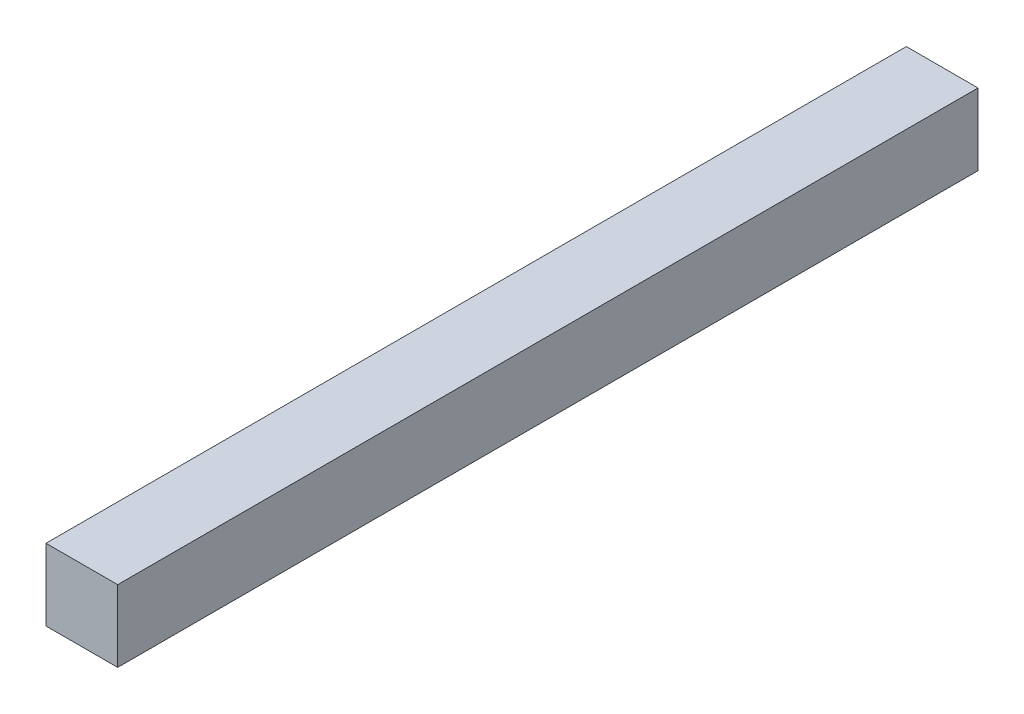
from build123d import *

# Parameters (mm, degrees)
SKETCH1_W           = 240
SKETCH1_H           = 20
BOSS_EXTRUDE1_DEPTH = 20
SKETCH2_W           = 0.610576923
SKETCH2_H           = 5.427350427
CUT_EXTRUDE1_DEPTH  = 4


with BuildPart() as part:
    # Sketch1 → Boss-Extrude1 (new body)
    with BuildSketch(Plane(origin=(0, 0, 0), x_dir=(0, 0, -1), z_dir=(1, 0, 0))):
        Rectangle(SKETCH1_W, SKETCH1_H)
    extrude(amount=BOSS_EXTRUDE1_DEPTH)

    # Sketch2 → Cut-Extrude1 (cut)
    # profile 1 of 6: a face of its own
    with BuildSketch(Plane(origin=(0, 0, 0), x_dir=(0, 0, -1), z_dir=(1, 0, 0))):
        with BuildLine():
            Line((-8.751602564, 5.427350427), (-9.362179487, 5.427350427))
            Line((-9.362179487, 5.427350427), (-9.362179487, 3.136626936))
            add(Edge.make_bspline(
                [(-9.362179487, 3.136626936), (-9.421668284, 3.200496063), (-9.538282896, 3.325697342), (-9.732047214, 3.487703852), (-9.932322109, 3.627202133), (-10.143270282, 3.739205359), (-10.362919536, 3.826800408), (-10.591827341, 3.889415018), (-10.82975499, 3.927467645), (-10.991305298, 3.932355358), (-11.073066907, 3.93482906)],
                knots=[0, 0, 0, 0, 1.07415008, 2.105633337, 3.103998732, 4.075565931, 5.040540589, 6.010859238, 6.993283574, 8, 8, 8, 8], degree=3))
            add(Edge.make_bspline(
                [(-11.073066907, 3.93482906), (-11.115140066, 3.934337126), (-11.198012626, 3.93336815), (-11.320435747, 3.922128741), (-11.439334916, 3.905280786), (-11.55492815, 3.88235118), (-11.666844517, 3.851419616), (-11.775008685, 3.812987353), (-11.87990196, 3.768628269), (-11.980730002, 3.718031271), (-12.075716596, 3.660350246), (-12.16584768, 3.599554702), (-12.249167468, 3.533332783), (-12.325823049, 3.462180231), (-12.395593801, 3.385644331), (-12.459636722, 3.305289996), (-12.5158899, 3.219345233), (-12.567791259, 3.128593488), (-12.613190351, 3.028065022), (-12.650694919, 2.915689145), (-12.681890166, 2.790384349), (-12.710237883, 2.652678599), (-12.728951301, 2.501273018), (-12.74428995, 2.337281871), (-12.752255474, 2.160417422), (-12.753585672, 2.038089349), (-12.754273504, 1.974834736)],
                knots=[0, 0, 0, 0, 1.021683283, 2.012435314, 2.983473585, 3.937869172, 4.872808728, 5.801185558, 6.724190829, 7.637729951, 8.538560957, 9.421760501, 10.276949778, 11.121084872, 11.959396615, 12.790471507, 13.614111827, 14.451940127, 15.327769077, 16.288588017, 17.325266595, 18.463133286, 19.701266581, 21.028475566, 22.463454662, 24, 24, 24, 24], degree=3))
            Line((-12.754273504, 1.974834736), (-12.754273504, 0))
            Line((-12.754273504, 0), (-12.143696581, 0))
            Line((-12.143696581, 0), (-12.143696581, 1.819010417))
            add(Edge.make_bspline(
                [(-12.143696581, 1.819010417), (-12.143558057, 1.871662121), (-12.143293067, 1.972382366), (-12.139537139, 2.116532517), (-12.136329475, 2.247366394), (-12.128273111, 2.364276534), (-12.120461991, 2.467583112), (-12.109720221, 2.557011842), (-12.09809782, 2.632986732), (-12.086411143, 2.678406458), (-12.081154848, 2.698834802)],
                knots=[0, 0, 0, 0, 1.429454469, 2.734479441, 3.915096125, 4.982083123, 5.9158061, 6.72734519, 7.427600459, 8, 8, 8, 8], degree=3))
            add(Edge.make_bspline(
                [(-12.081154848, 2.698834802), (-12.071716526, 2.729726568), (-12.053245782, 2.790181586), (-12.018341898, 2.876655997), (-11.976089483, 2.95653606), (-11.930460726, 3.031765724), (-11.877550112, 3.100068016), (-11.820537852, 3.162942351), (-11.757197314, 3.219586635), (-11.688465687, 3.270557736), (-11.613770605, 3.314614931), (-11.534642428, 3.354998099), (-11.449091583, 3.387028953), (-11.357987672, 3.413703066), (-11.262031058, 3.434776007), (-11.160036743, 3.449745892), (-11.052706831, 3.457864224), (-10.979090322, 3.459237149), (-10.941623264, 3.459935897)],
                knots=[0, 0, 0, 0, 1.040890899, 2.037017845, 2.999772166, 3.951073996, 4.869069183, 5.779972212, 6.683224964, 7.603478097, 8.53319658, 9.475456454, 10.463214634, 11.472278836, 12.533409461, 13.627045924, 14.792287113, 16, 16, 16, 16], degree=3))
            add(Edge.make_bspline(
                [(-10.941623264, 3.459935897), (-10.898125468, 3.459223869), (-10.812316437, 3.457819236), (-10.685065275, 3.443522416), (-10.561530673, 3.420099373), (-10.440588862, 3.388835222), (-10.324632133, 3.345549076), (-10.210609973, 3.2959497), (-10.101149846, 3.235227369), (-9.995281165, 3.166894898), (-9.896930136, 3.09071371), (-9.804713262, 3.011268091), (-9.722031541, 2.926541357), (-9.648639704, 2.83692262), (-9.583491446, 2.743691072), (-9.528131426, 2.645229123), (-9.481307928, 2.542696659), (-9.457001728, 2.471504885), (-9.444861779, 2.435947516)],
                knots=[0, 0, 0, 0, 1.077093923, 2.124806198, 3.16676328, 4.190026369, 5.214449133, 6.229293254, 7.267272823, 8.311139597, 9.347457364, 10.346171291, 11.324074378, 12.275494987, 13.212638205, 14.137563464, 15.069789411, 16, 16, 16, 16], degree=3))
            add(Edge.make_bspline(
                [(-9.444861779, 2.435947516), (-9.438169665, 2.410226644), (-9.423604085, 2.354244418), (-9.407619679, 2.261692315), (-9.392052649, 2.154351492), (-9.383133262, 2.031759), (-9.37254108, 1.894409359), (-9.367154865, 1.742364007), (-9.362353099, 1.575234639), (-9.362239085, 1.458958548), (-9.362179487, 1.398178753)],
                knots=[0, 0, 0, 0, 0.610940434, 1.329729645, 2.15826949, 3.104343598, 4.155103487, 5.326215764, 6.602360509, 8, 8, 8, 8], degree=3))
            Line((-9.362179487, 1.398178753), (-9.362179487, 0))
            Line((-9.362179487, 0), (-8.751602564, 0))
            Line((-8.751602564, 0), (-8.751602564, 5.427350427))
        make_face()
    # profile 2 of 6: a face of its own
    with BuildSketch(Plane(origin=(0, 0, 0), x_dir=(0, 0, -1), z_dir=(1, 0, 0))):
        Polygon((-6.377136752, 5.427350427), (-6.987713675, 5.427350427), (-6.987713675, 3.866987179), (-7.801816239, 3.866987179), (-7.801816239, 3.392094017), (-6.987713675, 3.392094017), (-6.987713675, 0), (-6.377136752, 0), (-6.377136752, 3.392094017), (-5.563034188, 3.392094017), (-5.563034188, 3.866987179), (-6.377136752, 3.866987179), align=None)
    # profile 3 of 6: a face of its own
    with BuildSketch(Plane(origin=(0, 0, 0), x_dir=(0, 0, -1), z_dir=(1, 0, 0))):
        with BuildLine():
            Line((-3.93482906, 3.866987179), (-4.545405983, 3.866987179))
            Line((-4.545405983, 3.866987179), (-4.545405983, 0.798202123))
            add(Edge.make_bspline(
                [(-4.545405983, 0.798202123), (-4.545240943, 0.732820739), (-4.544922304, 0.606590178), (-4.53570058, 0.424219199), (-4.52358332, 0.255523639), (-4.506078619, 0.100113642), (-4.481629768, -0.041307378), (-4.453184167, -0.169509355), (-4.420359952, -0.284409321), (-4.391589809, -0.354616076), (-4.377921341, -0.387970753)],
                knots=[0, 0, 0, 0, 1.301533202, 2.51284472, 3.634575474, 4.668610574, 5.625072911, 6.490366044, 7.282784772, 8, 8, 8, 8], degree=3))
            add(Edge.make_bspline(
                [(-4.377921341, -0.387970753), (-4.357908047, -0.43150625), (-4.318215534, -0.517850527), (-4.244060083, -0.639559609), (-4.158850333, -0.752835095), (-4.064194839, -0.859597429), (-3.958701949, -0.95843615), (-3.842628916, -1.049740083), (-3.71628201, -1.133778404), (-3.579402029, -1.208482713), (-3.433844145, -1.275489873), (-3.280248661, -1.333120952), (-3.120255776, -1.383754887), (-2.952315443, -1.422047516), (-2.778097855, -1.454448576), (-2.596079423, -1.475974205), (-2.407211999, -1.490518045), (-2.27873878, -1.491845597), (-2.213341346, -1.492521368)],
                knots=[0, 0, 0, 0, 0.892361144, 1.769826507, 2.649562032, 3.531070128, 4.425493976, 5.339743849, 6.280293132, 7.249898151, 8.242834287, 9.264015286, 10.305378017, 11.367518935, 12.471830068, 13.606296802, 14.781520001, 16, 16, 16, 16], degree=3))
            add(Edge.make_bspline(
                [(-2.213341346, -1.492521368), (-2.118207741, -1.491222444), (-1.932464228, -1.488686361), (-1.661715771, -1.459368849), (-1.405036427, -1.417709788), (-1.165299406, -1.354853383), (-0.943923682, -1.277825478), (-0.742570927, -1.189010091), (-0.562082597, -1.088747116), (-0.400546348, -0.972818082), (-0.254547455, -0.835114758), (-0.116222332, -0.673381421), (0.016523246, -0.484144733), (0.094888882, -0.344212293), (0.135683761, -0.271367521)],
                knots=[0, 0, 0, 0, 1.220149806, 2.382280289, 3.490641873, 4.554024904, 5.557741845, 6.495463758, 7.374449758, 8.202461232, 9.039706035, 9.943084277, 10.9292293, 12, 12, 12, 12], degree=3))
            Line((0.135683761, -0.271367521), (-0.474893162, -0.271367521))
            add(Edge.make_bspline(
                [(-0.474893162, -0.271367521), (-0.519447092, -0.332200691), (-0.607336708, -0.452203663), (-0.768684554, -0.605630443), (-0.946354299, -0.73614642), (-1.110064697, -0.823561811), (-1.250401876, -0.879066453), (-1.3622078, -0.916294976), (-1.480273133, -0.948509936), (-1.604756047, -0.972983278), (-1.735132133, -0.993883069), (-1.871802195, -1.006909284), (-2.014648444, -1.015679133), (-2.111917926, -1.016971013), (-2.161399907, -1.017628205)],
                knots=[0, 0, 0, 0, 1.406411641, 2.774367649, 4.13970867, 5.515970748, 6.226996413, 6.957671546, 7.716753095, 8.511703955, 9.326821042, 10.182754768, 11.075548767, 12, 12, 12, 12], degree=3))
            add(Edge.make_bspline(
                [(-2.161399907, -1.017628205), (-2.210174792, -1.016967501), (-2.306031196, -1.01566903), (-2.4467679, -1.00695501), (-2.581986706, -0.993670999), (-2.711035789, -0.973274657), (-2.834686878, -0.948191661), (-2.952121008, -0.916329046), (-3.063907787, -0.87905923), (-3.170008566, -0.837114713), (-3.268779764, -0.788992247), (-3.361461581, -0.73993744), (-3.445692506, -0.686163459), (-3.523321634, -0.630419363), (-3.593161156, -0.570873518), (-3.656404734, -0.509346702), (-3.711702665, -0.444382526), (-3.760820734, -0.375320979), (-3.802591958, -0.298451716), (-3.839004574, -0.211971478), (-3.867658355, -0.113540908), (-3.893534257, -0.004727454), (-3.911846901, 0.115847828), (-3.925884856, 0.247398647), (-3.932527519, 0.390378085), (-3.93404411, 0.489376067), (-3.93482906, 0.540614984)],
                knots=[0, 0, 0, 0, 1.284615551, 2.524631777, 3.71274724, 4.861840311, 5.964270962, 7.034369188, 8.064422103, 9.066774622, 10.036673369, 10.956946004, 11.82705178, 12.666609064, 13.47215512, 14.242132945, 14.988114445, 15.716233977, 16.470126793, 17.287679463, 18.182663732, 19.166922939, 20.231828452, 21.392172702, 22.650252828, 24, 24, 24, 24], degree=3))
            Line((-3.93482906, 0.540614984), (-3.93482906, 0.740960537))
            add(Edge.make_bspline(
                [(-3.93482906, 0.740960537), (-3.87814683, 0.683392198), (-3.764682515, 0.568154103), (-3.570599741, 0.419493126), (-3.35880585, 0.292036824), (-3.130743584, 0.186587921), (-2.890466092, 0.102589883), (-2.64061644, 0.044058671), (-2.383750669, 0.006196652), (-2.209941846, 0.002079111), (-2.122178819, 0)],
                knots=[0, 0, 0, 0, 0.9616226, 1.924939268, 2.903225655, 3.90145387, 4.913304235, 5.930317158, 6.954934346, 8, 8, 8, 8], degree=3))
            add(Edge.make_bspline(
                [(-2.122178819, 0), (-2.070561788, 0.000790342), (-1.96752531, 0.002368002), (-1.814373416, 0.015828452), (-1.663509749, 0.035391068), (-1.515288983, 0.064501341), (-1.369338277, 0.101178178), (-1.225937252, 0.14736591), (-1.084530786, 0.200183246), (-0.94640953, 0.261270977), (-0.813572503, 0.330030127), (-0.687324815, 0.403931861), (-0.568868102, 0.483705609), (-0.458713984, 0.569808161), (-0.355614619, 0.660723153), (-0.260702791, 0.757829721), (-0.173798187, 0.860484154), (-0.095359744, 0.96870809), (-0.025589435, 1.081180766), (0.036342233, 1.196181443), (0.087132601, 1.314965174), (0.129753477, 1.435587308), (0.162962534, 1.559251812), (0.185697156, 1.685874462), (0.201695624, 1.815069333), (0.202913557, 1.902350125), (0.203525641, 1.946213942)],
                knots=[0, 0, 0, 0, 1.102496069, 2.200771917, 3.282212953, 4.351067109, 5.425742796, 6.495236474, 7.567789237, 8.649230273, 9.719442957, 10.761602243, 11.772820946, 12.767879558, 13.746423923, 14.707251758, 15.666031455, 16.617263585, 17.559830464, 18.491849916, 19.404720472, 20.31668551, 21.223041296, 22.136535823, 23.063497827, 24, 24, 24, 24], degree=3))
            add(Edge.make_bspline(
                [(0.203525641, 1.946213942), (0.202316232, 1.990057992), (0.199901466, 2.077599234), (0.186343978, 2.207780616), (0.161926824, 2.335824583), (0.126189384, 2.460865557), (0.08319085, 2.584610186), (0.028838002, 2.70529273), (-0.035486579, 2.823628085), (-0.108155553, 2.939576686), (-0.189336155, 3.052031061), (-0.279828068, 3.157554607), (-0.376727249, 3.258246218), (-0.481656807, 3.351919996), (-0.593291509, 3.440917187), (-0.71354346, 3.521679971), (-0.839887467, 3.598957901), (-0.973752304, 3.667989443), (-1.112314876, 3.730050658), (-1.253000599, 3.78600366), (-1.396533994, 3.830621082), (-1.541136699, 3.87010409), (-1.688416472, 3.897647306), (-1.836875666, 3.919306883), (-1.987318684, 3.932431224), (-2.088232537, 3.934025045), (-2.13913929, 3.93482906)],
                knots=[0, 0, 0, 0, 0.927022606, 1.850940105, 2.763646773, 3.678917571, 4.597960441, 5.530863249, 6.473405952, 7.443374224, 8.422047587, 9.402429927, 10.379733957, 11.374159407, 12.373957143, 13.39539851, 14.434361868, 15.503500072, 16.57672747, 17.643462173, 18.701820727, 19.752719066, 20.810444757, 21.866850764, 22.923916819, 24, 24, 24, 24], degree=3))
            add(Edge.make_bspline(
                [(-2.13913929, 3.93482906), (-2.222629312, 3.932802344), (-2.387005517, 3.928812122), (-2.629226974, 3.896885248), (-2.862943058, 3.846722852), (-3.089552027, 3.773939584), (-3.310945221, 3.676107562), (-3.525826802, 3.544666571), (-3.736924345, 3.382916343), (-3.86753272, 3.25605441), (-3.93482906, 3.190688435)],
                knots=[0, 0, 0, 0, 1.000657623, 1.970107281, 2.924012196, 3.863137721, 4.818884552, 5.818573257, 6.876013614, 8, 8, 8, 8], degree=3))
            Line((-3.93482906, 3.190688435), (-3.93482906, 3.866987179))
        make_face()
        with BuildLine():
            add(Edge.make_bspline(
                [(-2.210161258, 3.459935897), (-2.130143012, 3.457569941), (-1.971654845, 3.452883807), (-1.738889872, 3.413127161), (-1.51399214, 3.351185846), (-1.301566206, 3.261705894), (-1.103065061, 3.153272129), (-0.926615579, 3.021084677), (-0.771307977, 2.871188034), (-0.64103998, 2.702440804), (-0.537170672, 2.52077092), (-0.4617408, 2.329599764), (-0.415498986, 2.130737444), (-0.409876119, 1.995216775), (-0.407051282, 1.927133413)],
                knots=[0, 0, 0, 0, 1.094811094, 2.168437986, 3.223641393, 4.281933969, 5.317030878, 6.312588996, 7.290981033, 8.263423301, 9.221049352, 10.146311928, 11.068737512, 12, 12, 12, 12], degree=3))
            add(Edge.make_bspline(
                [(-0.407051282, 1.927133413), (-0.408316407, 1.875798015), (-0.410807975, 1.77469683), (-0.435335487, 1.626606485), (-0.472569511, 1.485021349), (-0.527909707, 1.350808263), (-0.597842322, 1.223424763), (-0.683701784, 1.102963535), (-0.783713393, 0.988774438), (-0.89933017, 0.883462274), (-1.026784573, 0.787711331), (-1.163857487, 0.70332015), (-1.3108798, 0.633218842), (-1.466378454, 0.57459448), (-1.631739905, 0.530864528), (-1.805156161, 0.497374006), (-1.988192548, 0.478439903), (-2.113303202, 0.476093437), (-2.177300347, 0.474893162)],
                knots=[0, 0, 0, 0, 0.96111248, 1.892838345, 2.805071872, 3.698884346, 4.60559943, 5.522242918, 6.465191984, 7.44453383, 8.446901343, 9.448393885, 10.455190158, 11.494316124, 12.557523497, 13.656033041, 14.80100385, 16, 16, 16, 16], degree=3))
            add(Edge.make_bspline(
                [(-2.177300347, 0.474893162), (-2.241657208, 0.476069907), (-2.367836818, 0.47837706), (-2.552119595, 0.497719928), (-2.726947134, 0.52922646), (-2.891850791, 0.573877219), (-3.047511725, 0.630462546), (-3.192208348, 0.702822124), (-3.328689685, 0.784808658), (-3.453516529, 0.880747605), (-3.567040286, 0.985692883), (-3.664941215, 1.101082189), (-3.74830737, 1.22359181), (-3.816847204, 1.354013545), (-3.869990992, 1.492807329), (-3.908171141, 1.639578222), (-3.930764614, 1.794632507), (-3.933454357, 1.900557092), (-3.93482906, 1.954694177)],
                knots=[0, 0, 0, 0, 1.19578733, 2.34448939, 3.439297077, 4.493839214, 5.516052018, 6.51161546, 7.495918654, 8.470447695, 9.432171157, 10.363808737, 11.27629551, 12.180975096, 13.095609538, 14.032140546, 14.994245053, 16, 16, 16, 16], degree=3))
            add(Edge.make_bspline(
                [(-3.93482906, 1.954694177), (-3.932309676, 2.025220476), (-3.927377035, 2.1633022), (-3.884666631, 2.364589319), (-3.814344769, 2.553417301), (-3.716807721, 2.729588756), (-3.594754864, 2.891658864), (-3.446715643, 3.035281248), (-3.276351351, 3.161455925), (-3.084997546, 3.267433102), (-2.878714682, 3.35195289), (-2.663132627, 3.416081052), (-2.438927897, 3.452127062), (-2.286958271, 3.45731447), (-2.210161258, 3.459935897)],
                knots=[0, 0, 0, 0, 0.993273759, 1.944706513, 2.885586036, 3.824102814, 4.773434307, 5.734969173, 6.721162128, 7.75352746, 8.809825341, 9.857965814, 10.917534828, 12, 12, 12, 12], degree=3))
        make_face(mode=Mode.SUBTRACT)
    # profile 4 of 6: a face of its own
    with BuildSketch(Plane(origin=(0, 0, 0), x_dir=(0, 0, -1), z_dir=(1, 0, 0))):
        with BuildLine():
            Line((5.291666667, 3.866987179), (4.681089744, 3.866987179))
            Line((4.681089744, 3.866987179), (4.681089744, 3.169487847))
            add(Edge.make_bspline(
                [(4.681089744, 3.169487847), (4.622349396, 3.233028209), (4.507208466, 3.357577974), (4.315509835, 3.517707407), (4.114613568, 3.650761583), (3.904204668, 3.756635586), (3.683574328, 3.836156551), (3.454186291, 3.893399897), (3.215066157, 3.928113914), (3.052646578, 3.932568109), (2.970202324, 3.93482906)],
                knots=[0, 0, 0, 0, 1.071615931, 2.100546913, 3.086831835, 4.052383644, 5.012467513, 5.987526731, 6.978467626, 8, 8, 8, 8], degree=3))
            add(Edge.make_bspline(
                [(2.970202324, 3.93482906), (2.928129166, 3.934337125), (2.845256606, 3.933368148), (2.722833478, 3.922128749), (2.603934337, 3.905280758), (2.488341, 3.88235128), (2.376425007, 3.851419251), (2.268259463, 3.812988701), (2.163371272, 3.768623293), (2.062524551, 3.718049525), (1.967606138, 3.660283708), (1.877044959, 3.599671484), (1.794456133, 3.53218548), (1.717383775, 3.461190599), (1.647735147, 3.384537304), (1.583272796, 3.304116274), (1.527712469, 3.217358301), (1.475425567, 3.126508129), (1.430094224, 3.025934553), (1.39257169, 2.913571969), (1.361371405, 2.788264498), (1.333140526, 2.650897103), (1.31422541, 2.499872095), (1.298996928, 2.336219489), (1.291026013, 2.159711102), (1.289686501, 2.037736151), (1.288995726, 1.974834736)],
                knots=[0, 0, 0, 0, 1.021877172, 2.012817222, 2.984039772, 3.938616479, 4.873733462, 5.802286475, 6.725466908, 7.639179397, 8.540181358, 9.423548511, 10.284267954, 11.128563244, 11.967034077, 12.798266685, 13.629233285, 14.467220584, 15.343215744, 16.304217022, 17.341092336, 18.479174964, 19.709034054, 21.03649491, 22.471746329, 24, 24, 24, 24], degree=3))
            Line((1.288995726, 1.974834736), (1.288995726, 0))
            Line((1.288995726, 0), (1.89957265, 0))
            Line((1.89957265, 0), (1.89957265, 1.819010417))
            add(Edge.make_bspline(
                [(1.89957265, 1.819010417), (1.89986037, 1.871658977), (1.90041073, 1.972366711), (1.902230072, 2.116551185), (1.906291374, 2.247325103), (1.912854289, 2.364269351), (1.919756599, 2.467546966), (1.929256376, 2.557007965), (1.940308754, 2.63277522), (1.950240126, 2.678381266), (1.954694177, 2.698834802)],
                knots=[0, 0, 0, 0, 1.430932559, 2.737130458, 3.918967929, 4.986496826, 5.920444988, 6.731744033, 7.431208747, 8, 8, 8, 8], degree=3))
            add(Edge.make_bspline(
                [(1.954694177, 2.698834802), (1.962159817, 2.729774668), (1.976791454, 2.790412593), (2.009484924, 2.876137119), (2.046566688, 2.957029104), (2.090706968, 3.031579042), (2.141304251, 3.100278386), (2.197372728, 3.163599329), (2.261701621, 3.219175754), (2.330553195, 3.270883873), (2.406431993, 3.314901111), (2.486977943, 3.354442539), (2.573521645, 3.387538825), (2.665618745, 3.413280436), (2.762806481, 3.435084396), (2.865947275, 3.449608629), (2.974657936, 3.457892464), (3.048983482, 3.459246744), (3.086805556, 3.459935897)],
                knots=[0, 0, 0, 0, 1.023331376, 2.005590166, 2.946770166, 3.884853604, 4.787816592, 5.689704838, 6.600084485, 7.51894743, 8.457030868, 9.418263533, 10.404529548, 11.433908737, 12.493436355, 13.607926131, 14.782744311, 16, 16, 16, 16], degree=3))
            add(Edge.make_bspline(
                [(3.086805556, 3.459935897), (3.13065637, 3.459223563), (3.217169556, 3.457818199), (3.345477576, 3.443523234), (3.470069683, 3.420098279), (3.592066247, 3.388840712), (3.709083625, 3.345550427), (3.824164579, 3.29596565), (3.934678506, 3.235233925), (4.041623758, 3.166923994), (4.140955367, 3.090657259), (4.234310529, 3.011649331), (4.316932272, 2.926181658), (4.391491821, 2.837002715), (4.457548598, 2.743677196), (4.514242057, 2.645519817), (4.560842057, 2.542663917), (4.585187749, 2.471493978), (4.597347423, 2.435947516)],
                knots=[0, 0, 0, 0, 1.07948023, 2.129704468, 3.174109644, 4.199790071, 5.226392724, 6.243251684, 7.282788827, 8.32784619, 9.365013745, 10.364450704, 11.336624801, 12.288018167, 13.22465538, 14.148474442, 15.075238997, 16, 16, 16, 16], degree=3))
            add(Edge.make_bspline(
                [(4.597347423, 2.435947516), (4.604452802, 2.409890164), (4.619876537, 2.353327152), (4.635830305, 2.259978207), (4.649440556, 2.152074965), (4.660697621, 2.029725652), (4.670515184, 1.892623795), (4.676197754, 1.740957153), (4.680885912, 1.574526099), (4.6810199, 1.458604564), (4.681089744, 1.398178753)],
                knots=[0, 0, 0, 0, 0.6207052, 1.347372354, 2.17470453, 3.121361084, 4.171954432, 5.334763797, 6.610706278, 8, 8, 8, 8], degree=3))
            Line((4.681089744, 1.398178753), (4.681089744, 0))
            Line((4.681089744, 0), (5.291666667, 0))
            Line((5.291666667, 0), (5.291666667, 3.866987179))
        make_face()
    # profile 5 of 6: a face of its own
    with BuildSketch(Plane(origin=(0, 0, 0), x_dir=(0, 0, -1), z_dir=(1, 0, 0))):
        with BuildLine():
            Line((7.080996261, 1.221153846), (6.580662393, 0.999607706))
            add(Edge.make_bspline(
                [(6.580662393, 0.999607706), (6.621603791, 0.939760858), (6.701915164, 0.82236422), (6.839180243, 0.663521119), (6.982807542, 0.519607698), (7.139303823, 0.39645767), (7.304619941, 0.288866302), (7.4793773, 0.195531876), (7.663423347, 0.114445632), (7.858311309, 0.0473694), (8.065068685, -0.004546296), (8.284123932, -0.041184023), (8.516149408, -0.063892228), (8.675226537, -0.066501951), (8.756902711, -0.06784188)],
                knots=[0, 0, 0, 0, 1.028550373, 2.01762266, 2.975264797, 3.910578725, 4.838520313, 5.772057253, 6.71983626, 7.690602934, 8.69423223, 9.742300095, 10.840812058, 12, 12, 12, 12], degree=3))
            add(Edge.make_bspline(
                [(8.756902711, -0.06784188), (8.847084892, -0.066109105), (9.022977927, -0.062729468), (9.279329831, -0.033580329), (9.520969286, 0.01363379), (9.747642113, 0.080141521), (9.959074603, 0.16632434), (10.155269765, 0.271765767), (10.33674349, 0.395949267), (10.499703885, 0.539531709), (10.64621345, 0.693115996), (10.774144038, 0.853938635), (10.883318068, 1.019545631), (10.971368848, 1.19111545), (11.041290859, 1.366626854), (11.089966895, 1.547678814), (11.120932537, 1.733491141), (11.124350037, 1.859523496), (11.126068376, 1.922893296)],
                knots=[0, 0, 0, 0, 1.253497118, 2.444844522, 3.581709244, 4.67290735, 5.723851329, 6.750306004, 7.764127638, 8.773906301, 9.764221974, 10.711745802, 11.627392092, 12.517240337, 13.388450951, 14.248888345, 15.119530894, 16, 16, 16, 16], degree=3))
            add(Edge.make_bspline(
                [(11.126068376, 1.922893296), (11.124493338, 1.982354114), (11.121366144, 2.100411866), (11.094645579, 2.274599766), (11.053946183, 2.444707285), (10.993653714, 2.609046908), (10.918405018, 2.7691327), (10.824966225, 2.923372135), (10.716103746, 3.0737452), (10.631606987, 3.166722517), (10.58863348, 3.214009081)],
                knots=[0, 0, 0, 0, 0.994594993, 1.974739895, 2.942858905, 3.917440094, 4.898815115, 5.898775058, 6.931355414, 8, 8, 8, 8], degree=3))
            add(Edge.make_bspline(
                [(10.58863348, 3.214009081), (10.530423527, 3.271464746), (10.414782903, 3.385606891), (10.221916817, 3.533388608), (10.013782964, 3.657250089), (9.791880296, 3.759542223), (9.55473361, 3.83733269), (9.304488154, 3.895500102), (9.039011805, 3.927837366), (8.857335519, 3.932461597), (8.764322917, 3.93482906)],
                knots=[0, 0, 0, 0, 0.971468177, 1.929930888, 2.87924043, 3.845173235, 4.827968633, 5.840649589, 6.894479818, 8, 8, 8, 8], degree=3))
            add(Edge.make_bspline(
                [(8.764322917, 3.93482906), (8.668440901, 3.932823089), (8.481263828, 3.928907113), (8.208049954, 3.8915166), (7.949733025, 3.833000187), (7.705819169, 3.749828125), (7.476600823, 3.642531936), (7.262817048, 3.510244405), (7.06329968, 3.354782876), (6.94474867, 3.234473586), (6.884890825, 3.173727965)],
                knots=[0, 0, 0, 0, 1.100780758, 2.148900583, 3.160985341, 4.138993548, 5.103074933, 6.061595952, 7.02127625, 8, 8, 8, 8], degree=3))
            add(Edge.make_bspline(
                [(6.884890825, 3.173727965), (6.844743964, 3.128189569), (6.76529107, 3.038066525), (6.662845407, 2.890272562), (6.577172388, 2.733902166), (6.505657191, 2.569691936), (6.449044161, 2.397309485), (6.409432497, 2.216135335), (6.382960752, 2.02683373), (6.379101319, 1.897543425), (6.377136752, 1.831730769)],
                knots=[0, 0, 0, 0, 0.991024859, 1.961293861, 2.930016615, 3.899340981, 4.883129092, 5.888537453, 6.925202031, 8, 8, 8, 8], degree=3))
            Line((6.377136752, 1.831730769), (10.515491453, 1.831730769))
            add(Edge.make_bspline(
                [(10.515491453, 1.831730769), (10.512738177, 1.78072443), (10.507311186, 1.680185691), (10.479741514, 1.533626771), (10.440300821, 1.393375287), (10.383077512, 1.26159147), (10.312853212, 1.135933996), (10.226327134, 1.01846446), (10.125766167, 0.907381031), (10.01211537, 0.804461153), (9.887054215, 0.711282645), (9.75376237, 0.630137554), (9.613666605, 0.56005505), (9.466108635, 0.504380012), (9.311203161, 0.460292405), (9.149288853, 0.430613808), (8.9803707, 0.410361206), (8.865441277, 0.408170506), (8.806724092, 0.407051282)],
                knots=[0, 0, 0, 0, 0.989560905, 1.9505263, 2.8851385, 3.809141245, 4.729580329, 5.671124297, 6.631674319, 7.630937612, 8.639554004, 9.651353955, 10.653385491, 11.672697909, 12.705190456, 13.77221026, 14.861827209, 16, 16, 16, 16], degree=3))
            add(Edge.make_bspline(
                [(8.806724092, 0.407051282), (8.749442566, 0.407997018), (8.635331586, 0.409881026), (8.465629018, 0.427291264), (8.29827395, 0.456336038), (8.134646152, 0.495021102), (7.977839487, 0.542853107), (7.832542001, 0.600382893), (7.699034184, 0.663942168), (7.574382764, 0.736446393), (7.453638412, 0.825635413), (7.333151932, 0.936845679), (7.205679009, 1.069003494), (7.124084571, 1.168573183), (7.080996261, 1.221153846)],
                knots=[0, 0, 0, 0, 1.038720112, 2.069242521, 3.090194857, 4.117703715, 5.117086279, 6.060835234, 6.949442673, 7.796883902, 8.672359865, 9.666054705, 10.767492468, 12, 12, 12, 12], degree=3))
        make_face()
        with BuildLine():
            add(Edge.make_bspline(
                [(6.987713675, 2.306623932), (7.008556278, 2.369721631), (7.048849295, 2.491702397), (7.130492877, 2.659877627), (7.223335857, 2.8096274), (7.334009872, 2.938913748), (7.460126351, 3.052708895), (7.60355898, 3.154000519), (7.765646206, 3.242790577), (7.943738084, 3.318850377), (8.132303664, 3.382765798), (8.328887295, 3.426457997), (8.529876451, 3.455784315), (8.665987927, 3.458543948), (8.734642094, 3.459935897)],
                knots=[0, 0, 0, 0, 1.059200688, 2.047651669, 2.975137365, 3.863037386, 4.753100469, 5.679145756, 6.658227321, 7.696087836, 8.765769263, 9.829790172, 10.905353532, 12, 12, 12, 12], degree=3))
            add(Edge.make_bspline(
                [(8.734642094, 3.459935897), (8.790864516, 3.4590198), (8.901455901, 3.457217807), (9.064168997, 3.439965371), (9.220594178, 3.410906339), (9.37178894, 3.372648904), (9.515746069, 3.319603134), (9.655036795, 3.258469995), (9.787580386, 3.184262621), (9.870737808, 3.126366561), (9.912334736, 3.097405849)],
                knots=[0, 0, 0, 0, 1.076055584, 2.116637343, 3.127623239, 4.120225418, 5.098058948, 6.060968605, 7.030059552, 8, 8, 8, 8], degree=3))
            add(Edge.make_bspline(
                [(9.912334736, 3.097405849), (9.941765921, 3.074621749), (10.001056811, 3.028721812), (10.082240547, 2.949492755), (10.159060008, 2.863313477), (10.230719081, 2.768753504), (10.294412457, 2.664133283), (10.355302652, 2.553213149), (10.409823568, 2.433430368), (10.44043642, 2.34959919), (10.456129808, 2.306623932)],
                knots=[0, 0, 0, 0, 0.916062907, 1.845463751, 2.788616269, 3.758101748, 4.762692155, 5.802440563, 6.873442008, 8, 8, 8, 8], degree=3))
            Line((10.456129808, 2.306623932), (6.987713675, 2.306623932))
        make_face(mode=Mode.SUBTRACT)
    # profile 6 of 6: a face of its own
    with BuildSketch(Plane(origin=(0, 0, 0), x_dir=(0, 0, -1), z_dir=(1, 0, 0))):
        with Locations((12.516826924, 2.713675214)):
            Rectangle(SKETCH2_W, SKETCH2_H)
    extrude(amount=CUT_EXTRUDE1_DEPTH, mode=Mode.SUBTRACT)


solid = part.part
